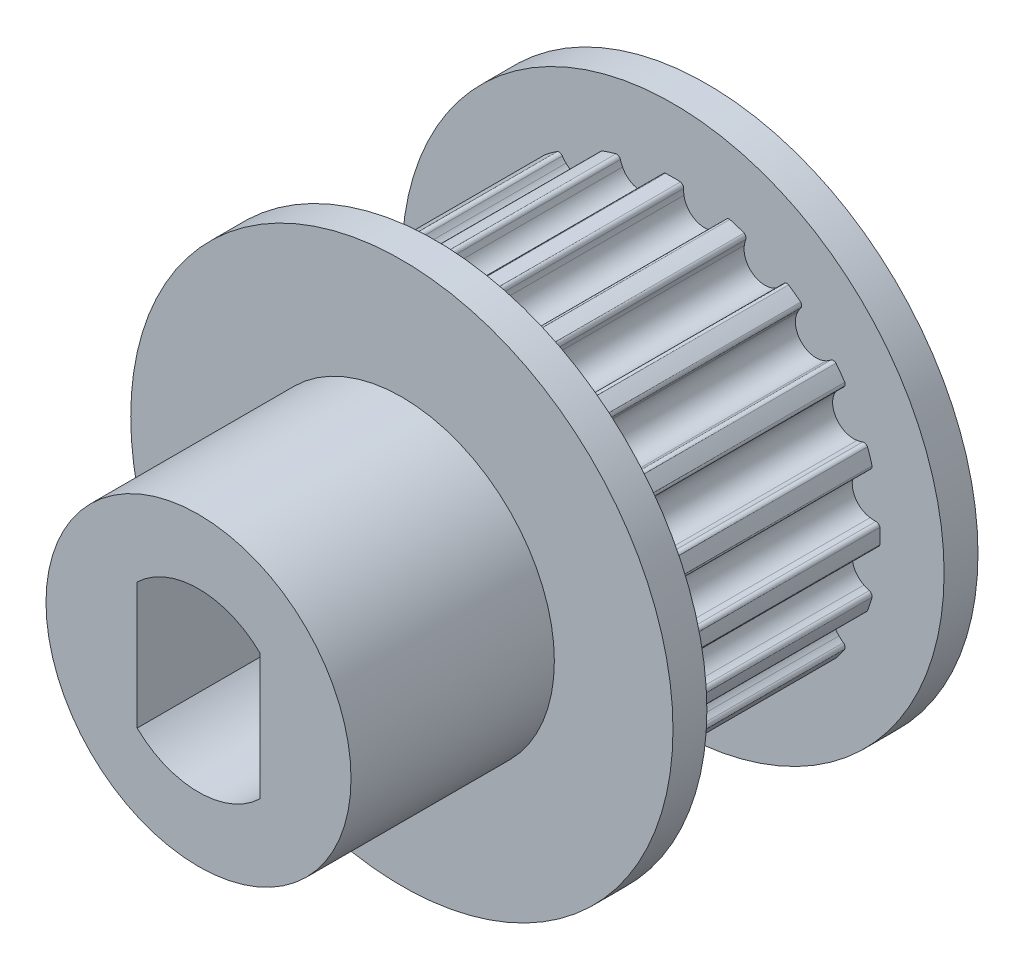
from build123d import *

# Parameters (mm, degrees)
CUT_EXTRUDE1_DEPTH  = 7
BOSS_EXTRUDE1_DEPTH = 9
BOSS_EXTRUDE2_START = 6
SKETCH18_R          = 4.5
BOSS_EXTRUDE2_DEPTH = 6
CIRPATTERN1_COUNT   = 20
SKETCH19_R          = 8
SKETCH19_R_2        = 4.55
SKETCH19_R_3        = 4.4
CUT_EXTRUDE2_DEPTH  = 1
SKETCH19_3_R        = 8
SKETCH19_3_R_2      = 4.55
BOSS_EXTRUDE3_DEPTH = 1


with BuildPart() as part:
    # Sketch5 → Revolve1 (revolve)
    with BuildSketch(Plane(origin=(0, 0, 0), x_dir=(0, 0, -1), z_dir=(1, 0, 0)), mode=Mode.PRIVATE) as revolve1_sk:
        Polygon((0.5, 8), (0.5, 6.11), (7.5, 6.11), (7.5, 8), (8.5, 8), (8.5, 2.6), (-0.5, 2.6), (-0.5, 8), align=None)
    revolve(revolve1_sk.sketch.rotate(Axis((0, 0, 0), (0, 0, -1)), 90), axis=Axis((0, 0, 0), (0, 0, -1)))

    # Sketch6 → Cut-Extrude1 (cut)
    with BuildSketch(Plane.XY.offset(-0.5)):
        with BuildLine():
            Line((0, 6.112197724), (0, 6.366197724))
            ThreePointArc((0, 6.366197724), (0.995892735, 6.287819266), (1.967263286, 6.054613829))
            Line((1.967263286, 6.054613829), (1.88877297, 5.813045474))
            ThreePointArc((1.88877297, 5.813045474), (1.794613714, 5.842800924), (1.699986032, 5.871031298))
            ThreePointArc((1.699986032, 5.871031298), (1.60929489, 5.861193456), (1.551726022, 5.790429823))
            ThreePointArc((1.551726022, 5.790429823), (1.52370277, 5.709893157), (1.4890504, 5.63197865))
            ThreePointArc((1.4890504, 5.63197865), (0.838832532, 5.296180172), (0.324206028, 5.816471874))
            ThreePointArc((0.324206028, 5.816471874), (0.315326573, 5.901281145), (0.313562076, 5.986535727))
            ThreePointArc((0.313562076, 5.986535727), (0.280677993, 6.071625699), (0.197465653, 6.109007148))
            ThreePointArc((0.197465653, 6.109007148), (0.098745714, 6.111400028), (0, 6.112197724))
        make_face()
    cut_extrude1 = extrude(amount=-CUT_EXTRUDE1_DEPTH, mode=Mode.SUBTRACT)

    # Sketch17 → Boss-Extrude1 (add)
    with BuildSketch(Plane.XY.offset(0.5)):
        with BuildLine():
            Line((-1.81, -1.866520828), (-1.81, 1.866520828))
            ThreePointArc((-1.81, 1.866520828), (-2.6, 0), (-1.81, -1.866520828))
        make_face()
        with BuildLine():
            ThreePointArc((2.6, 0), (2.394368393, 1.013410085), (1.81, 1.866520828))
            Line((1.81, 1.866520828), (1.81, -1.866520828))
            ThreePointArc((1.81, -1.866520828), (2.394368393, -1.013410085), (2.6, 0))
        make_face()
    extrude(amount=-BOSS_EXTRUDE1_DEPTH)

    # Sketch18 → Boss-Extrude2 (add)
    with BuildSketch(Plane.XY.offset(0.5).offset(BOSS_EXTRUDE2_START)):
        with Locations(Location((0, 0, 0), (0, 0, 180))):
            Circle(SKETCH18_R)
        with BuildLine():
            Line((-1.81, 1.866520828), (-1.81, -1.866520828))
            ThreePointArc((-1.81, -1.866520828), (0, -2.6), (1.81, -1.866520828))
            Line((1.81, -1.866520828), (1.81, 1.866520828))
            ThreePointArc((1.81, 1.866520828), (0, 2.6), (-1.81, 1.866520828))
        make_face(mode=Mode.SUBTRACT)
    extrude(amount=-BOSS_EXTRUDE2_DEPTH)

    # CirPattern1: Cut-Extrude1 ×20 about axis
    cirpattern1_axis = Axis((0, 0, 0), (0, 0, 1))
    for i in range(1, CIRPATTERN1_COUNT):
        add(cut_extrude1.rotate(cirpattern1_axis, i * 360 / CIRPATTERN1_COUNT), mode=Mode.SUBTRACT)

    # Sketch19 → Cut-Extrude2 (cut)
    # profile 1 of 2: a face of its own
    with BuildSketch(Plane(origin=(0, 0, -8.5), x_dir=(-1, 0, 0), z_dir=(0, 0, -1))):
        with Locations(Location((0, 0, 0), (0, 0, 180))):
            Circle(SKETCH19_R)
        Circle(SKETCH19_R_2, mode=Mode.SUBTRACT)
    # profile 2 of 2: a face of its own
    with BuildSketch(Plane(origin=(0, 0, -8.5), x_dir=(-1, 0, 0), z_dir=(0, 0, -1))):
        Circle(SKETCH19_R_2)
        Circle(SKETCH19_R_3, mode=Mode.SUBTRACT)
    extrude(amount=-CUT_EXTRUDE2_DEPTH, mode=Mode.SUBTRACT)


with BuildPart() as body_2:
    # Sketch19<3> → Boss-Extrude3 (new body)
    with BuildSketch(Plane(origin=(0, 0, -8.5), x_dir=(-1, 0, 0), z_dir=(0, 0, -1))):
        Circle(SKETCH19_3_R)
        Circle(SKETCH19_3_R_2, mode=Mode.SUBTRACT)
    extrude(amount=-BOSS_EXTRUDE3_DEPTH)


solid = Compound([part.part, body_2.part])
